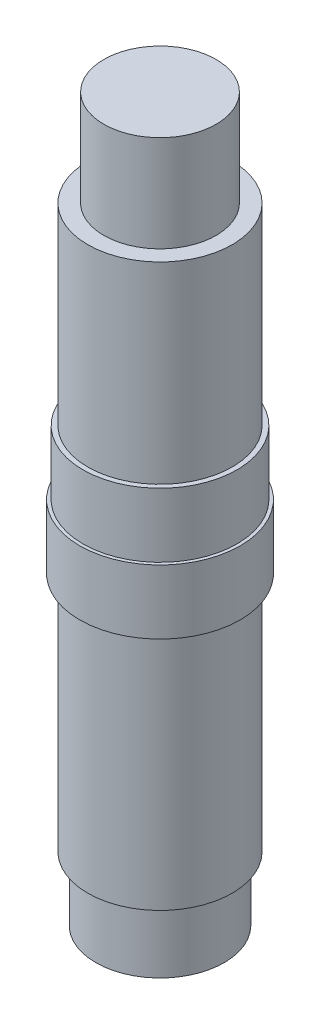
from build123d import *

# Parameters (mm, degrees)
SKETCH_1_R      = 20
EXTRUDE_1_DEPTH = 20
SKETCH_2_R      = 22.5
EXTRUDE_2_DEPTH = 75
SKETCH_3_R      = 25
EXTRUDE_3_DEPTH = 20
SKETCH_4_R      = 24
EXTRUDE_4_DEPTH = 20
SKETCH_5_R      = 22.5
EXTRUDE_5_DEPTH = 60
SKETCH_6_R      = 17.5
EXTRUDE_6_DEPTH = 30


with BuildPart() as part:
    # 草图1 → 凸台-拉伸1 (new body)
    with BuildSketch(Plane(origin=(0, 0, 0), x_dir=(1, 0, 0), z_dir=(0, 1, 0))):
        with Locations(Location((0, 0, 0), (0, 0, 270))):
            Circle(SKETCH_1_R)
    extrude(amount=EXTRUDE_1_DEPTH)


with BuildPart() as body_2:
    # 草图2 → 凸台-拉伸2 (new body)
    with BuildSketch(Plane(origin=(0, 20, 0), x_dir=(1, 0, 0), z_dir=(0, 1, 0))):
        with Locations(Location((0, 0, 0), (0, 0, 270))):
            Circle(SKETCH_2_R)
    extrude(amount=EXTRUDE_2_DEPTH)


with BuildPart() as body_3:
    # 草图3 → 凸台-拉伸3 (new body)
    with BuildSketch(Plane(origin=(0, 95, 0), x_dir=(1, 0, 0), z_dir=(0, 1, 0))):
        with Locations(Location((0, 0, 0), (0, 0, 270))):
            Circle(SKETCH_3_R)
    extrude(amount=EXTRUDE_3_DEPTH)


with BuildPart() as body_4:
    # 草图4 → 凸台-拉伸4 (new body)
    with BuildSketch(Plane(origin=(0, 115, 0), x_dir=(1, 0, 0), z_dir=(0, 1, 0))):
        with Locations(Location((0, 0, 0), (0, 0, 270))):
            Circle(SKETCH_4_R)
    extrude(amount=EXTRUDE_4_DEPTH)


with BuildPart() as body_5:
    # 草图5 → 凸台-拉伸5 (new body)
    with BuildSketch(Plane(origin=(0, 135, 0), x_dir=(1, 0, 0), z_dir=(0, 1, 0))):
        with Locations(Location((0, 0, 0), (0, 0, 270))):
            Circle(SKETCH_5_R)
    extrude(amount=EXTRUDE_5_DEPTH)


with BuildPart() as body_6:
    # 草图6 → 凸台-拉伸6 (new body)
    with BuildSketch(Plane(origin=(0, 195, 0), x_dir=(1, 0, 0), z_dir=(0, 1, 0))):
        with Locations(Location((0, 0, 0), (0, 0, 270))):
            Circle(SKETCH_6_R)
    extrude(amount=EXTRUDE_6_DEPTH)


solid = Compound([part.part, body_2.part, body_3.part, body_4.part, body_5.part, body_6.part])
